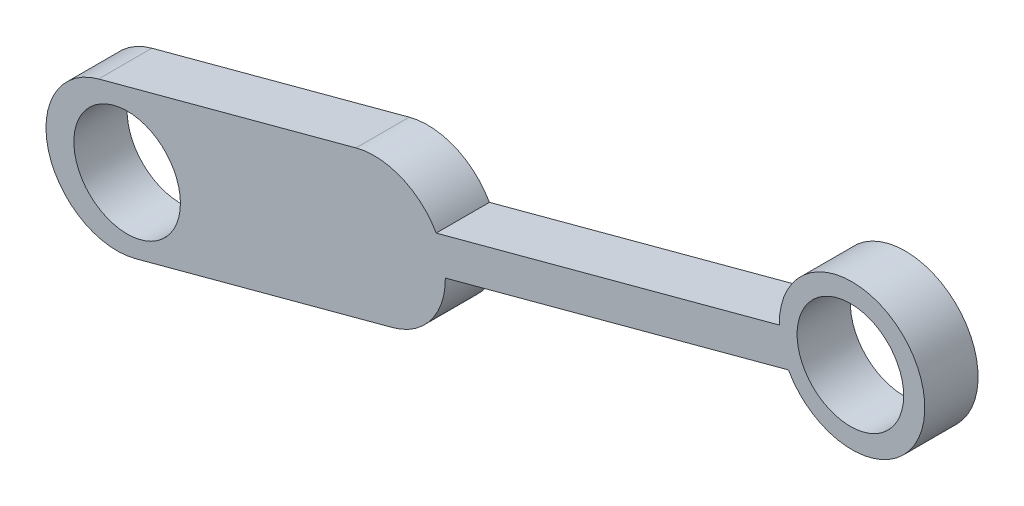
from build123d import *

# Parameters (mm, degrees)
BOSS_EXTRUDE2_DEPTH = 3
SKETCH2_R           = 3
CUT_EXTRUDE1_DEPTH  = 3


with BuildPart() as part:
    # Sketch1 → Boss-Extrude2 (new body)
    with BuildSketch(Plane.XY):
        with BuildLine():
            Line((-130.844076507, 34.249167122), (-116.355189112, 38.131452799))
            ThreePointArc((-116.355189112, 38.131452799), (-113.772345212, 37.956249752), (-111.837717338, 36.236077171))
            Line((-111.837717338, 36.236077171), (-92.519200812, 41.412458074))
            ThreePointArc((-92.519200812, 41.412458074), (-84.463501584, 42.535699996), (-92.001562722, 39.480606421))
            Line((-92.001562722, 39.480606421), (-111.320079248, 34.304225519))
            ThreePointArc((-111.320079248, 34.304225519), (-112.135429844, 31.847198428), (-114.284636752, 30.404046189))
            Line((-114.284636752, 30.404046189), (-128.773524146, 26.521760512))
            ThreePointArc((-128.773524146, 26.521760512), (-133.672503631, 29.350187637), (-130.844076507, 34.249167122))
        make_face()
    extrude(amount=BOSS_EXTRUDE2_DEPTH)

    # Sketch2 → Cut-Extrude1 (cut)
    with BuildSketch(Plane.XY.offset(3)):
        with Locations((-88.51462095, 41.468697455)):
            Circle(SKETCH2_R)
        with Locations((-129.239464025, 30.489755696)):
            Circle(SKETCH2_R)
    extrude(amount=-CUT_EXTRUDE1_DEPTH, mode=Mode.SUBTRACT)


solid = part.part
